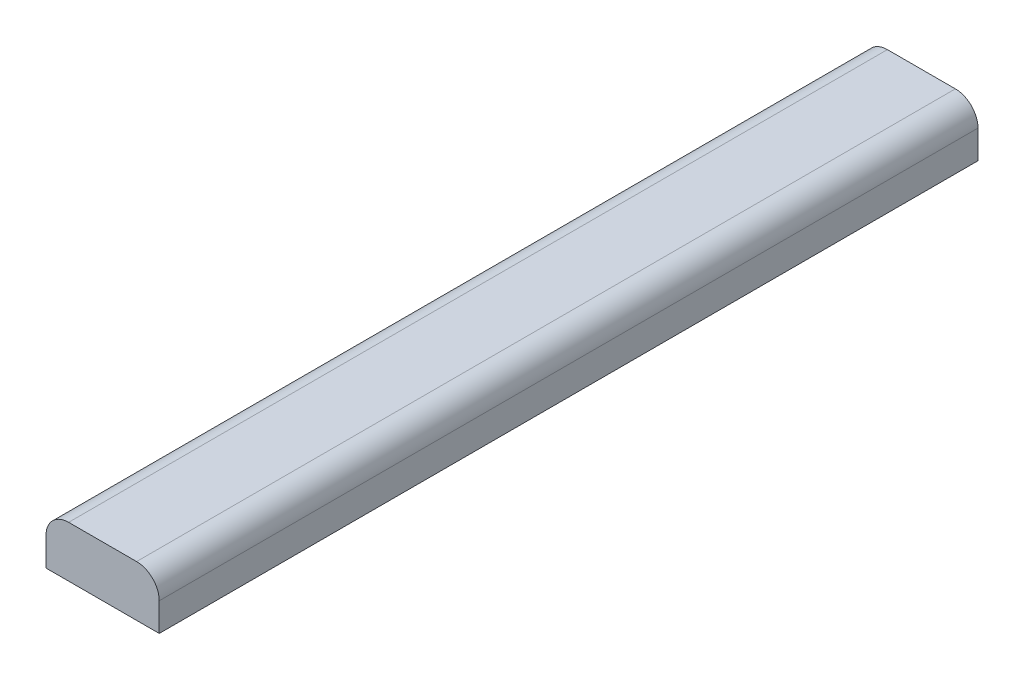
from build123d import *

# Parameters (mm, degrees)
BOSS_EXTRUDE1_DEPTH = 918.21


with BuildPart() as part:
    # Sketch1 → Boss-Extrude1 (new body)
    with BuildSketch(Plane.XY):
        with BuildLine():
            Line((0, 0), (127, 0))
            Line((127, 0), (127, 31.75))
            ThreePointArc((127, 31.75), (119.560512242, 49.710512242), (101.6, 57.15))
            Line((101.6, 57.15), (25.4, 57.15))
            ThreePointArc((25.4, 57.15), (7.439487758, 49.710512242), (0, 31.75))
            Line((0, 31.75), (0, 0))
        make_face()
    extrude(amount=BOSS_EXTRUDE1_DEPTH)


solid = part.part
